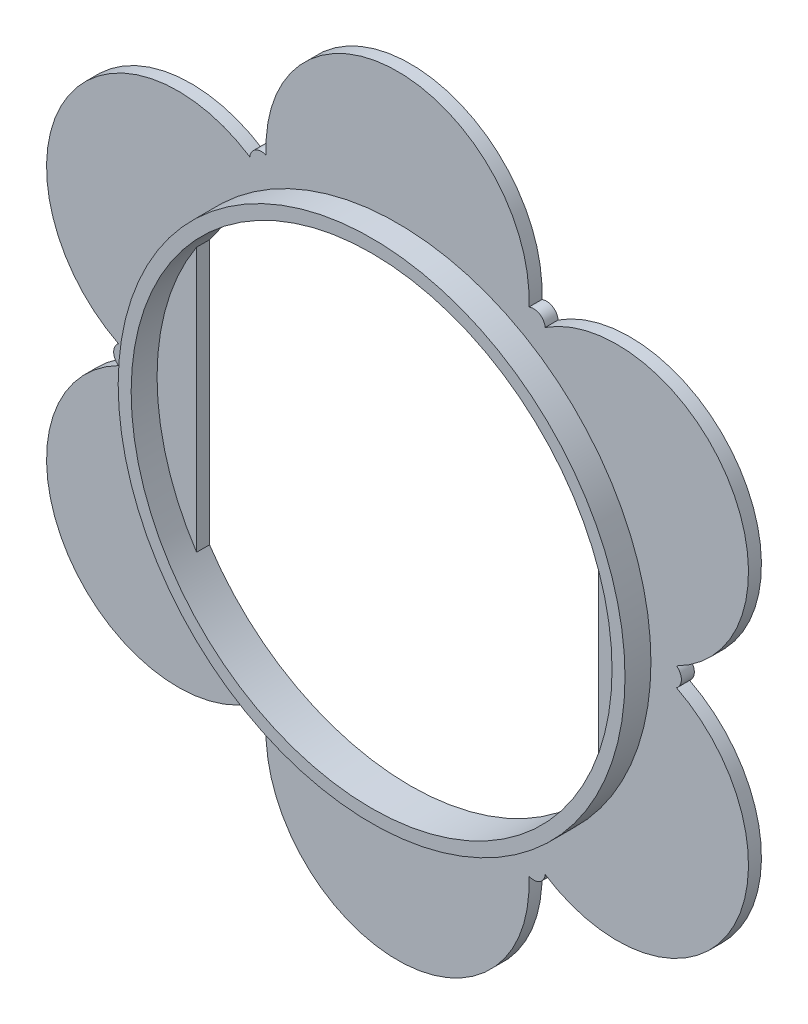
from build123d import *

# Parameters (mm, degrees)
BACK_PLATE_DEPTH    = 2
SKETCH3_R           = 39.1
SKETCH3_R_2         = 37.1
BOSS_EXTRUDE2_DEPTH = 4


with BuildPart() as part:
    # Sketch2 → Back Plate (new body)
    with BuildSketch(Plane.XY.offset(1.869079413)):
        with BuildLine():
            ThreePointArc((-22.788405672, 36.551599508), (-51.432945039, 29.694824664), (-43.048816559, 1.45953847))
            ThreePointArc((-43.048816559, 1.45953847), (-43.466528344, 1.037157748), (-43.724007211, 0.501813707))
            ThreePointArc((-43.724007211, 0.501813707), (-43.795371043, 0), (-43.724007211, -0.501813707))
            ThreePointArc((-43.724007211, -0.501813707), (-43.466528344, -1.037157748), (-43.048816559, -1.45953847))
            ThreePointArc((-43.048816559, -1.45953847), (-51.432945039, -29.694824664), (-22.788405672, -36.551599508))
            ThreePointArc((-22.788405672, -36.551599508), (-22.63146913, -37.124538886), (-22.296587024, -37.615194147))
            ThreePointArc((-22.296587024, -37.615194147), (-21.897685521, -37.927903891), (-21.427420187, -38.117007854))
            ThreePointArc((-21.427420187, -38.117007854), (-20.835059214, -38.161696634), (-20.260410887, -38.011137978))
            ThreePointArc((-20.260410887, -38.011137978), (0, -59.389649327), (20.260410887, -38.011137978))
            ThreePointArc((20.260410887, -38.011137978), (20.835059214, -38.161696634), (21.427420187, -38.117007854))
            ThreePointArc((21.427420187, -38.117007854), (21.897685521, -37.927903891), (22.296587024, -37.615194147))
            ThreePointArc((22.296587024, -37.615194147), (22.63146913, -37.124538886), (22.788405672, -36.551599508))
            ThreePointArc((22.788405672, -36.551599508), (51.432945039, -29.694824664), (43.048816559, -1.45953847))
            ThreePointArc((43.048816559, -1.45953847), (43.466528344, -1.037157748), (43.724007211, -0.501813707))
            ThreePointArc((43.724007211, -0.501813707), (43.795371043, 0), (43.724007211, 0.501813707))
            ThreePointArc((43.724007211, 0.501813707), (43.466528344, 1.037157748), (43.048816559, 1.45953847))
            ThreePointArc((43.048816559, 1.45953847), (51.432945039, 29.694824664), (22.788405672, 36.551599508))
            ThreePointArc((22.788405672, 36.551599508), (22.63146913, 37.124538886), (22.296587024, 37.615194147))
            ThreePointArc((22.296587024, 37.615194147), (21.897685521, 37.927903891), (21.427420187, 38.117007854))
            ThreePointArc((21.427420187, 38.117007854), (20.835059214, 38.161696634), (20.260410887, 38.011137978))
            ThreePointArc((20.260410887, 38.011137978), (0, 59.389649327), (-20.260410887, 38.011137978))
            ThreePointArc((-20.260410887, 38.011137978), (-21.897685521, 37.927903891), (-22.788405672, 36.551599508))
        make_face()
        with BuildLine():
            Line((-31, 20.381609357), (-31, -20.381609357))
            ThreePointArc((-31, -20.381609357), (0, -37.1), (31, -20.381609357))
            Line((31, -20.381609357), (31, 20.381609357))
            ThreePointArc((31, 20.381609357), (0, 37.1), (-31, 20.381609357))
        make_face(mode=Mode.SUBTRACT)
    extrude(amount=BACK_PLATE_DEPTH)

    # Sketch3 → Boss-Extrude2 (add)
    with BuildSketch(Plane.XY.offset(3.869079413)):
        Circle(SKETCH3_R)
        with Locations(Location((0, 0, 0), (0, 0, 146.676229541))):
            Circle(SKETCH3_R_2, mode=Mode.SUBTRACT)
    extrude(amount=BOSS_EXTRUDE2_DEPTH)


solid = part.part
